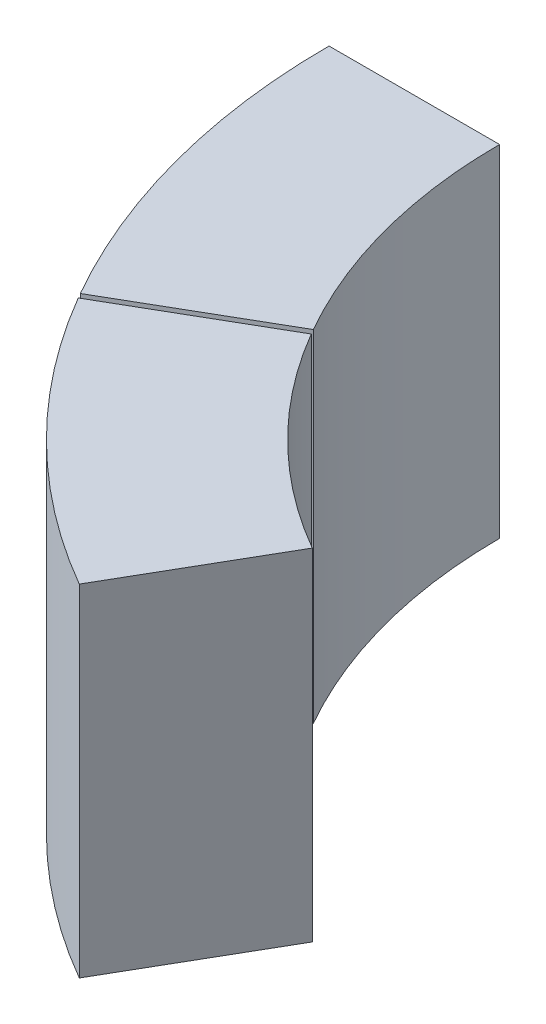
from build123d import *

# Parameters (mm, degrees)
EXTRUDE_1_DEPTH     = 600
CUT_EXTRUDE_1_DEPTH = 600
EXTRUDE_2_DEPTH     = 100
SHELL_1_T           = -10
EXTRUDE_3_DEPTH     = 10


with BuildPart() as part:
    # 草图1 → 凸台-拉伸1 (new body)
    with BuildSketch(Plane(origin=(0, 0, 0), x_dir=(1, 0, 0), z_dir=(0, 1, 0))):
        with BuildLine():
            ThreePointArc((-900, 0), (-779.422863406, -450), (-450, -779.422863406))
            Line((-450, -779.422863406), (-600, -1039.230484541))
            ThreePointArc((-600, -1039.230484541), (-1039.230484541, -600), (-1200, 0))
            Line((-1200, 0), (-900, 0))
        make_face()
    extrude(amount=EXTRUDE_1_DEPTH)

    # 草图2 → 切除-拉伸1 (cut)
    with BuildSketch(Plane(origin=(0, 600, 0), x_dir=(1, 0, 0), z_dir=(0, 1, 0))):
        Polygon((-57.795907874, -27.594980277), (-1097.026392415, -627.594980277), (-1080.637446236, -629.679823172), (-41.406961694, -29.679823172), align=None)
    extrude(amount=-CUT_EXTRUDE_1_DEPTH, mode=Mode.SUBTRACT)


with BuildPart() as cut_extrude_1_piece_1:
    # of the separate pieces the step leaves, piece 1, a body of its own (cut_extrude_1_pieces)
    add(part.part.solids().sort_by_distance((-600, 0, 1039.230484541))[0])



with BuildPart() as cut_extrude_1_piece_2:
    # of the separate pieces the step leaves, piece 2, a body of its own (cut_extrude_1_pieces)
    add(part.part.solids().sort_by_distance((-1200, 0, 0))[0])


with BuildPart() as cut_extrude_1_piece_1_1:
    add(cut_extrude_1_piece_1.part)

    add(cut_extrude_1_piece_2.part)  # 凸台-拉伸2 merges 切除-拉伸1 piece 2
    # 草图3 → 凸台-拉伸2 (add)
    with BuildSketch(Plane.XZ):
        with BuildLine():
            Line((-825.212105372, 470.662928483), (-998.420193215, 570.664664625))
            ThreePointArc((-998.420193215, 570.664664625), (-995.929606575, 575.00022645), (-993.420193215, 579.324918663))
            Line((-993.420193215, 579.324918663), (-820.212105372, 479.323182521))
            ThreePointArc((-820.212105372, 479.323182521), (-822.723500531, 474.9996345), (-825.212105372, 470.662928483))
        make_face()
    extrude(amount=-EXTRUDE_2_DEPTH)

    # 抽壳1
    shell_1_openings = [cut_extrude_1_piece_1_1.faces().sort_by_distance(p)[0] for p in [
        (-1010.404998502, 600, 268.177938118),
        (-737.451406396, 600, 740.947427754),
    ]]
    offset(amount=SHELL_1_T, openings=shell_1_openings, kind=Kind.INTERSECTION)

    # 草图4 → 凸台-拉伸3 (add)
    with BuildSketch(Plane(origin=(0, 600, 0), x_dir=(1, 0, 0), z_dir=(0, 1, 0))):
        with BuildLine():
            Line((-463.632780681, -783.035532194), (-603.639245264, -1025.533842239))
            ThreePointArc((-603.639245264, -1025.533842239), (-839.687348019, -843.223076995), (-1022.988355102, -607.943110271))
            Line((-1022.988355102, -607.943110271), (-780.47604659, -467.928563671))
            ThreePointArc((-780.47604659, -467.928563671), (-641.696808412, -645.232675919), (-463.632780681, -783.035532194))
        make_face()
        with BuildLine():
            Line((-909.945053286, -10), (-1189.957982451, -10))
            ThreePointArc((-1189.957982451, -10), (-1150.096279744, -305.579036124), (-1037.988355102, -581.962348158))
            Line((-1037.988355102, -581.962348158), (-795.47604659, -441.947801557))
            ThreePointArc((-795.47604659, -441.947801557), (-879.636292904, -233.109399653), (-909.945053286, -10))
        make_face()
    extrude(amount=-EXTRUDE_3_DEPTH)


solid = cut_extrude_1_piece_1_1.part
